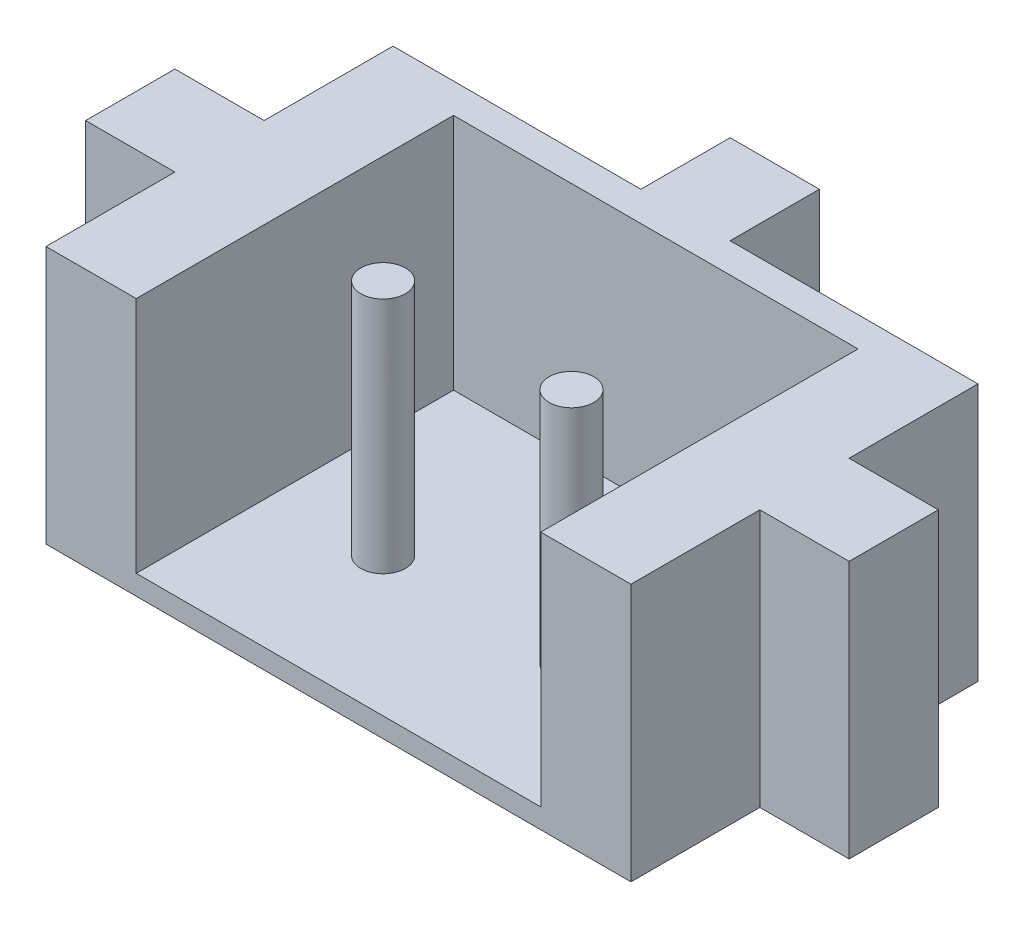
from build123d import *

# Parameters (mm, degrees)
SALIENTE_EXTRUIR1_DEPTH = 13
CROQUIS4_W              = 20.4
CROQUIS4_H              = 16
CROQUIS4_R              = 1.125
CORTAR_EXTRUIR1_DEPTH   = 12


with BuildPart() as part:
    # Croquis2 → Saliente-Extruir1 (new body)
    with BuildSketch(Plane(origin=(0, 0, 0), x_dir=(1, 0, 0), z_dir=(0, 1, 0))):
        Polygon((14.75, -8.75), (-14.75, -8.75), (-14.75, -2.25), (-19.25, -2.25), (-19.25, 2.25), (-14.75, 2.25), (-14.75, 8.75), (-2.25, 8.75), (-2.25, 13.25), (2.25, 13.25), (2.25, 8.75), (14.75, 8.75), (14.75, 2.25), (19.25, 2.25), (19.25, -2.25), (14.75, -2.25), align=None)
    extrude(amount=SALIENTE_EXTRUIR1_DEPTH)

    # Croquis4 → Cortar-Extruir1 (cut)
    with BuildSketch(Plane(origin=(0, 13, 0), x_dir=(1, 0, 0), z_dir=(0, 1, 0))):
        with Locations((0, -0.75)):
            Rectangle(CROQUIS4_W, CROQUIS4_H)
        with Locations(Location((4.75, -1.75, 0), (0, 0, 270))):
            Circle(CROQUIS4_R, mode=Mode.SUBTRACT)
        with Locations(Location((-4.75, -1.75, 0), (0, 0, 270))):
            Circle(CROQUIS4_R, mode=Mode.SUBTRACT)
    extrude(amount=-CORTAR_EXTRUIR1_DEPTH, mode=Mode.SUBTRACT)


solid = part.part
